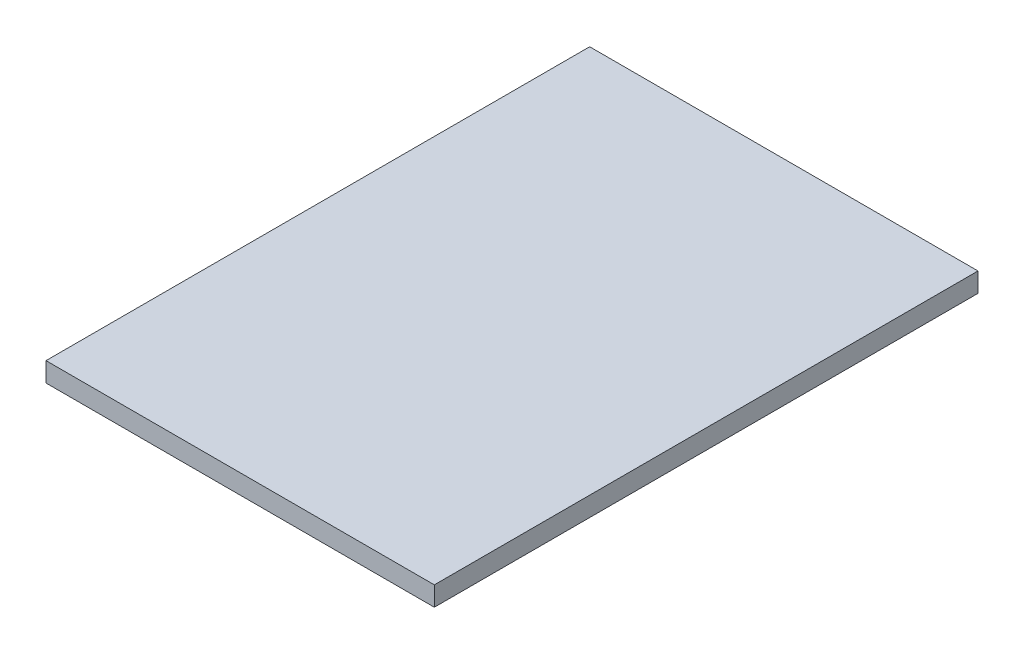
from build123d import *

# Parameters (mm, degrees)
SKETCH1_W           = 180
SKETCH1_H           = 252
BOSS_EXTRUDE1_DEPTH = 4.5


with BuildPart() as part:
    # Sketch1 → Boss-Extrude1 (new, symmetric)
    with BuildSketch(Plane(origin=(0, 0, 0), x_dir=(1, 0, 0), z_dir=(0, 1, 0))):
        Rectangle(SKETCH1_W, SKETCH1_H)
    extrude(amount=BOSS_EXTRUDE1_DEPTH, both=True)


solid = part.part
